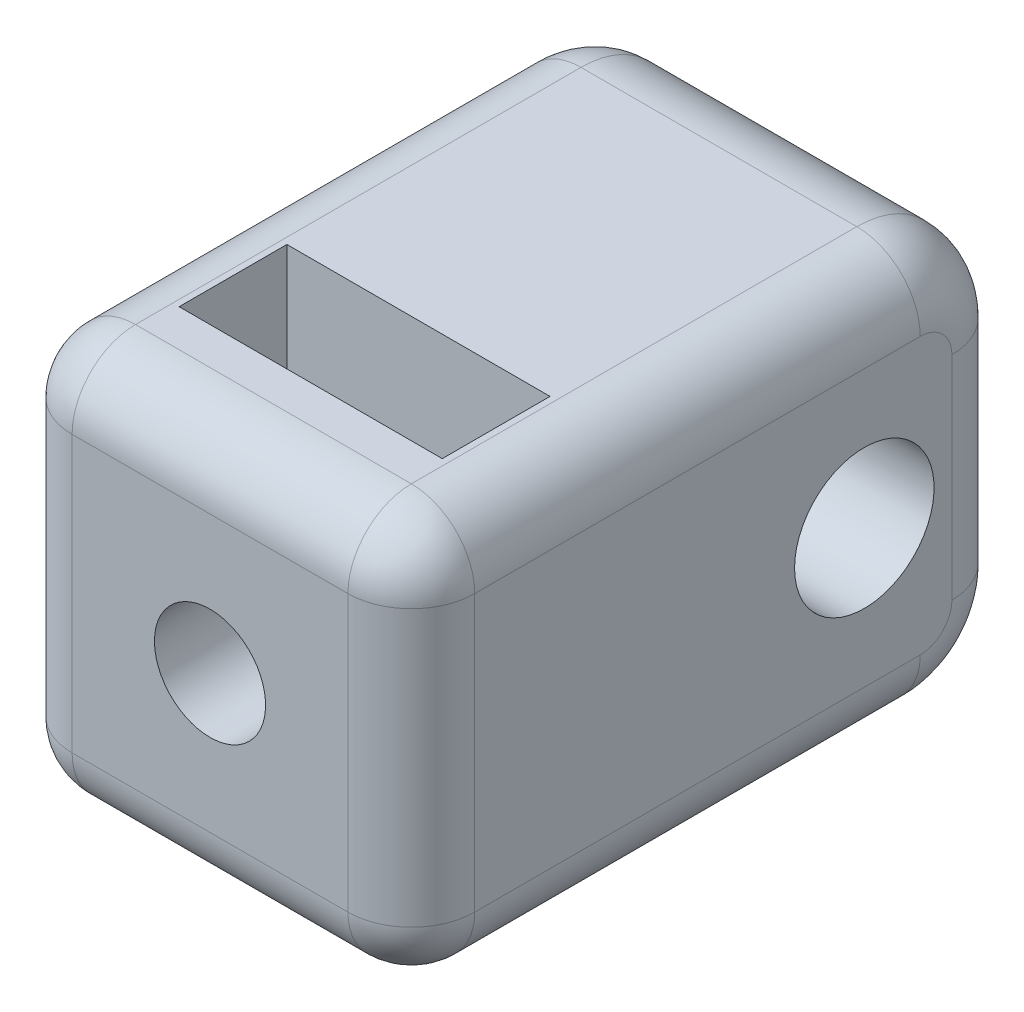
from build123d import *

# Parameters (mm, degrees)
SKETCH1_W           = 50.8
SKETCH1_H           = 19.05
BOSS_EXTRUDE1_DEPTH = 12.7
SKETCH2_R           = 2.2
CUT_EXTRUDE1_DEPTH  = 56.72102386
SKETCH4_R           = 1.7525
CUT_EXTRUDE3_DEPTH  = 3.4
CUT_EXTRUDE4_START  = -3.4
SKETCH4_3_R         = 1.7525
CUT_EXTRUDE4_DEPTH  = 3
CUT_EXTRUDE5_REACH  = 56.717
SKETCH4_4_R         = 1.7525
CUT_EXTRUDE6_REACH  = 57.721
SKETCH5_W           = 38.1
SKETCH5_H           = 19.05
FILLET1_R           = 3
FILLET2_R           = 2
FILLET3_R           = 2


with BuildPart() as part:
    # Sketch1 → Boss-Extrude1 (new body)
    with BuildSketch(Plane(origin=(0, 0, 0), x_dir=(1, 0, 0), z_dir=(0, 1, 0))):
        with Locations((-25.4, -9.525)):
            Rectangle(SKETCH1_W, SKETCH1_H)
    extrude(amount=BOSS_EXTRUDE1_DEPTH)

    # Sketch2 → Cut-Extrude1 (cut, through all)
    with BuildSketch(Plane.ZY.offset(50.8)):
        with Locations((4.7625, 6.35)):
            Circle(SKETCH2_R)
    extrude(amount=-CUT_EXTRUDE1_DEPTH, mode=Mode.SUBTRACT)

    # Sketch4 → Cut-Extrude3 (cut)
    # profile 1 of 9: a face of its own
    with BuildSketch(Plane.XY.offset(15.875)):
        Polygon((-40.3, 12.7), (-40.3, 8.746003617), (-44.45, 11.142007234), (-48.6, 8.746003617), (-48.6, 12.7), align=None)
    # profile 2 of 9: a face of its own
    with BuildSketch(Plane.XY.offset(15.875)):
        Polygon((-48.6, 8.746003617), (-48.6, 3.953996383), (-44.45, 1.557992766), (-40.3, 3.953996383), (-40.3, 8.746003617), (-44.45, 11.142007234), align=None)
        with Locations((-44.45, 6.35)):
            Circle(SKETCH4_R, mode=Mode.SUBTRACT)
    # profile 3 of 9: a face of its own
    with BuildSketch(Plane.XY.offset(15.875)):
        Polygon((-35.9, 12.7), (-27.6, 12.7), (-27.6, 8.746003617), (-27.6, 3.953996383), (-31.75, 1.557992766), (-35.9, 3.953996383), (-35.9, 8.746003617), align=None)
        with Locations((-31.75, 6.35)):
            Circle(SKETCH4_R, mode=Mode.SUBTRACT)
    # profile 4 of 9: a face of its own
    with BuildSketch(Plane.XY.offset(15.875)):
        with Locations((-31.75, 6.35)):
            Circle(SKETCH4_R)
    # profile 5 of 9: a face of its own
    with BuildSketch(Plane.XY.offset(15.875)):
        with Locations((-44.45, 6.35)):
            Circle(SKETCH4_R)
    # profile 6 of 9: a face of its own
    with BuildSketch(Plane.XY.offset(15.875)):
        Polygon((-23.2, 12.7), (-14.9, 12.7), (-14.9, 8.746003617), (-14.9, 3.953996383), (-19.05, 1.557992766), (-23.2, 3.953996383), (-23.2, 8.746003617), align=None)
        with Locations((-19.05, 6.35)):
            Circle(SKETCH4_R, mode=Mode.SUBTRACT)
    # profile 7 of 9: a face of its own
    with BuildSketch(Plane.XY.offset(15.875)):
        with Locations((-19.05, 6.35)):
            Circle(SKETCH4_R)
    # profile 8 of 9: a face of its own
    with BuildSketch(Plane.XY.offset(15.875)):
        Polygon((-10.5, 12.7), (-2.2, 12.7), (-2.2, 8.746003617), (-2.2, 3.953996383), (-6.35, 1.557992766), (-10.5, 3.953996383), (-10.5, 8.746003617), align=None)
        with Locations((-6.35, 6.35)):
            Circle(SKETCH4_R, mode=Mode.SUBTRACT)
    # profile 9 of 9: a face of its own
    with BuildSketch(Plane.XY.offset(15.875)):
        with Locations((-6.35, 6.35)):
            Circle(SKETCH4_R)
    extrude(amount=-CUT_EXTRUDE3_DEPTH, mode=Mode.SUBTRACT)

    # Sketch4<3> → Cut-Extrude4 (cut)
    with BuildSketch(Plane.XY.offset(15.875).offset(CUT_EXTRUDE4_START)):
        with Locations((-44.45, 6.35)):
            Circle(SKETCH4_3_R)
        with Locations((-31.75, 6.35)):
            Circle(SKETCH4_3_R)
        with Locations((-19.05, 6.35)):
            Circle(SKETCH4_3_R)
        with Locations((-6.35, 6.35)):
            Circle(SKETCH4_3_R)
    extrude(amount=-CUT_EXTRUDE4_DEPTH, mode=Mode.SUBTRACT)

    # Sketch4<4> → Cut-Extrude5 (cut, up to next)
    with BuildSketch(Plane.XY.offset(15.875), mode=Mode.PRIVATE) as cut_extrude5_sk1:
        with Locations((-44.45, 6.35)):
            Circle(SKETCH4_4_R)
    cut_extrude5_tool1 = extrude(cut_extrude5_sk1.sketch, amount=CUT_EXTRUDE5_REACH, mode=Mode.PRIVATE) & part.part
    # Sketch4<4> → Cut-Extrude5 (cut, up to next)
    with BuildSketch(Plane.XY.offset(15.875), mode=Mode.PRIVATE) as cut_extrude5_sk2:
        with Locations((-31.75, 6.35)):
            Circle(SKETCH4_4_R)
    cut_extrude5_tool2 = extrude(cut_extrude5_sk2.sketch, amount=CUT_EXTRUDE5_REACH, mode=Mode.PRIVATE) & part.part
    # Sketch4<4> → Cut-Extrude5 (cut, up to next)
    with BuildSketch(Plane.XY.offset(15.875), mode=Mode.PRIVATE) as cut_extrude5_sk3:
        with Locations((-19.05, 6.35)):
            Circle(SKETCH4_4_R)
    cut_extrude5_tool3 = extrude(cut_extrude5_sk3.sketch, amount=CUT_EXTRUDE5_REACH, mode=Mode.PRIVATE) & part.part
    # Sketch4<4> → Cut-Extrude5 (cut, up to next)
    with BuildSketch(Plane.XY.offset(15.875), mode=Mode.PRIVATE) as cut_extrude5_sk4:
        with Locations((-6.35, 6.35)):
            Circle(SKETCH4_4_R)
    cut_extrude5_tool4 = extrude(cut_extrude5_sk4.sketch, amount=CUT_EXTRUDE5_REACH, mode=Mode.PRIVATE) & part.part
    add(cut_extrude5_tool1.solids().sort_by_distance((-44.45, 6.35, 15.875))[0], mode=Mode.SUBTRACT)
    add(cut_extrude5_tool2.solids().sort_by_distance((-31.75, 6.35, 15.875))[0], mode=Mode.SUBTRACT)
    add(cut_extrude5_tool3.solids().sort_by_distance((-19.05, 6.35, 15.875))[0], mode=Mode.SUBTRACT)
    add(cut_extrude5_tool4.solids().sort_by_distance((-6.35, 6.35, 15.875))[0], mode=Mode.SUBTRACT)

    # Sketch5 → Cut-Extrude6 (cut, up to next)
    with BuildSketch(Plane(origin=(0, 12.7, 0), x_dir=(1, 0, 0), z_dir=(0, 1, 0)), mode=Mode.PRIVATE) as cut_extrude6_sk1:
        with Locations((-19.05, -9.525)):
            Rectangle(SKETCH5_W, SKETCH5_H)
    cut_extrude6_tool1 = extrude(cut_extrude6_sk1.sketch, amount=-CUT_EXTRUDE6_REACH, mode=Mode.PRIVATE) & part.part
    add(cut_extrude6_tool1.solids().sort_by_distance((-19.05, 12.7, 9.525))[0], mode=Mode.SUBTRACT)

    # Fillet1
    fillet1_edges = [part.edges().sort_by_distance(p)[0] for p in [
        (-44.45, 0, 0),
        (-44.45, 12.7, 0),
    ]]
    fillet(fillet1_edges, radius=FILLET1_R)

    # Fillet2
    fillet2_edges = [part.edges().sort_by_distance(p)[0] for p in [
        (-44.45, 12.7, 19.05),
        (-44.45, 0, 19.05),
    ]]
    fillet(fillet2_edges, radius=FILLET2_R)

    # Fillet3
    fillet3_edges = [part.edges().sort_by_distance(p)[0] for p in [
        (-38.1, 6.35, 0),
        (-50.8, 6.35, 0),
        (-50.8, 0, 10.025),
        (-50.8, 12.7, 10.025),
        (-50.8, 11.821320344, 0.878679656),
        (-50.8, 0.878679656, 0.878679656),
        (-38.1, 0, 10.025),
        (-38.1, 12.7, 10.025),
        (-38.1, 11.821320344, 0.878679656),
        (-38.1, 0.878679656, 0.878679656),
        (-38.1, 6.35, 19.05),
        (-50.8, 6.35, 19.05),
        (-38.1, 12.114213562, 18.464213562),
        (-38.1, 0.585786438, 18.464213562),
        (-50.8, 12.114213562, 18.464213562),
        (-50.8, 0.585786438, 18.464213562),
    ]]
    fillet(fillet3_edges, radius=FILLET3_R)


solid = part.part
